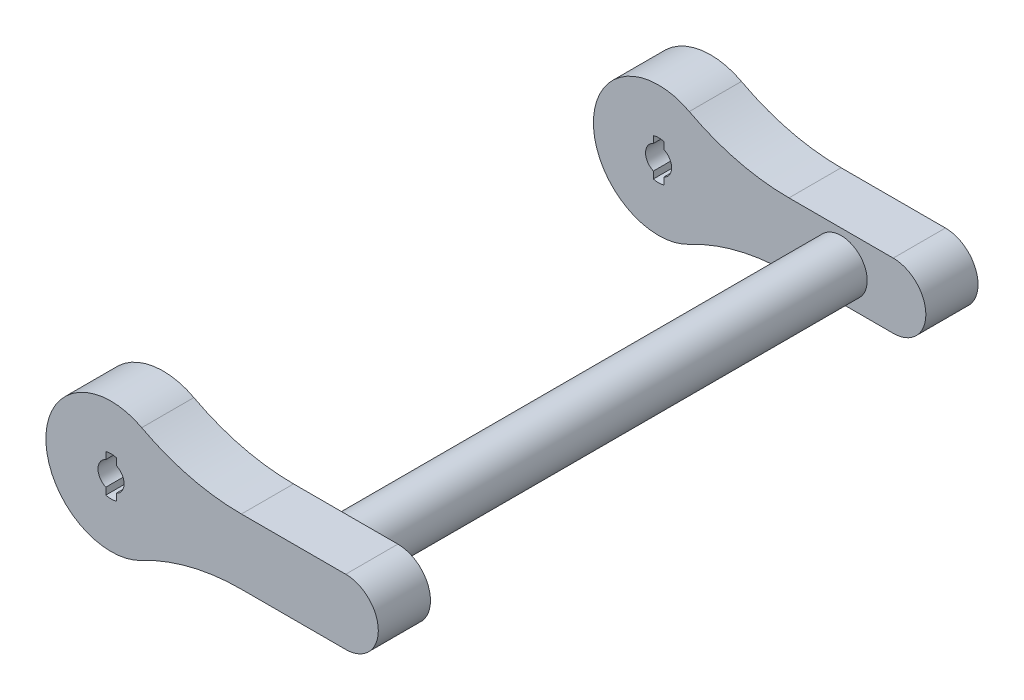
from build123d import *

# Parameters (mm, degrees)
BOSS_EXTRUDE1_DEPTH = 20
SKETCH2_R           = 5
CUT_EXTRUDE1_DEPTH  = 20
CUT_EXTRUDE2_DEPTH  = 20
SKETCH6_R           = 10
BOSS_EXTRUDE2_DEPTH = 95


with BuildPart() as part:
    # Sketch1 → Boss-Extrude1 (new body)
    with BuildSketch(Plane.XY):
        with BuildLine():
            Line((90, 12.5), (50, 12.5))
            ThreePointArc((50, 12.5), (30.293980466, 14.925921863), (11.764705882, 22.058823529))
            ThreePointArc((11.764705882, 22.058823529), (-25, 0), (11.764705882, -22.058823529))
            ThreePointArc((11.764705882, -22.058823529), (30.293980466, -14.925921863), (50, -12.5))
            Line((50, -12.5), (90, -12.5))
            ThreePointArc((90, -12.5), (102.5, 0), (90, 12.5))
        make_face()
    extrude(amount=BOSS_EXTRUDE1_DEPTH)

    # Sketch2 → Cut-Extrude1 (cut)
    with BuildSketch(Plane.XY.offset(20)):
        Circle(SKETCH2_R)
    extrude(amount=-CUT_EXTRUDE1_DEPTH, mode=Mode.SUBTRACT)

    # Sketch5 → Cut-Extrude2 (cut)
    with BuildSketch(Plane.XY.offset(20)):
        with BuildLine():
            Line((-2, 7.228416147), (-2, -7.228416147))
            ThreePointArc((-2, -7.228416147), (0, -7.5), (2, -7.228416147))
            Line((2, -7.228416147), (2, 7.228416147))
            ThreePointArc((2, 7.228416147), (0, 7.5), (-2, 7.228416147))
        make_face()
    extrude(amount=-CUT_EXTRUDE2_DEPTH, mode=Mode.SUBTRACT)

    # Sketch6 → Boss-Extrude2 (add)
    with BuildSketch(Plane.XY.offset(20)):
        with Locations((70, 0)):
            Circle(SKETCH6_R)
    extrude(amount=BOSS_EXTRUDE2_DEPTH)

    # Mirror1: part across plane


with BuildPart() as part_1:
    add(part.part)
    add(part.part.mirror(Plane(origin=(70, 0, 115), x_dir=(1, 0, 0), z_dir=(0, 0, 1))))


solid = part_1.part
